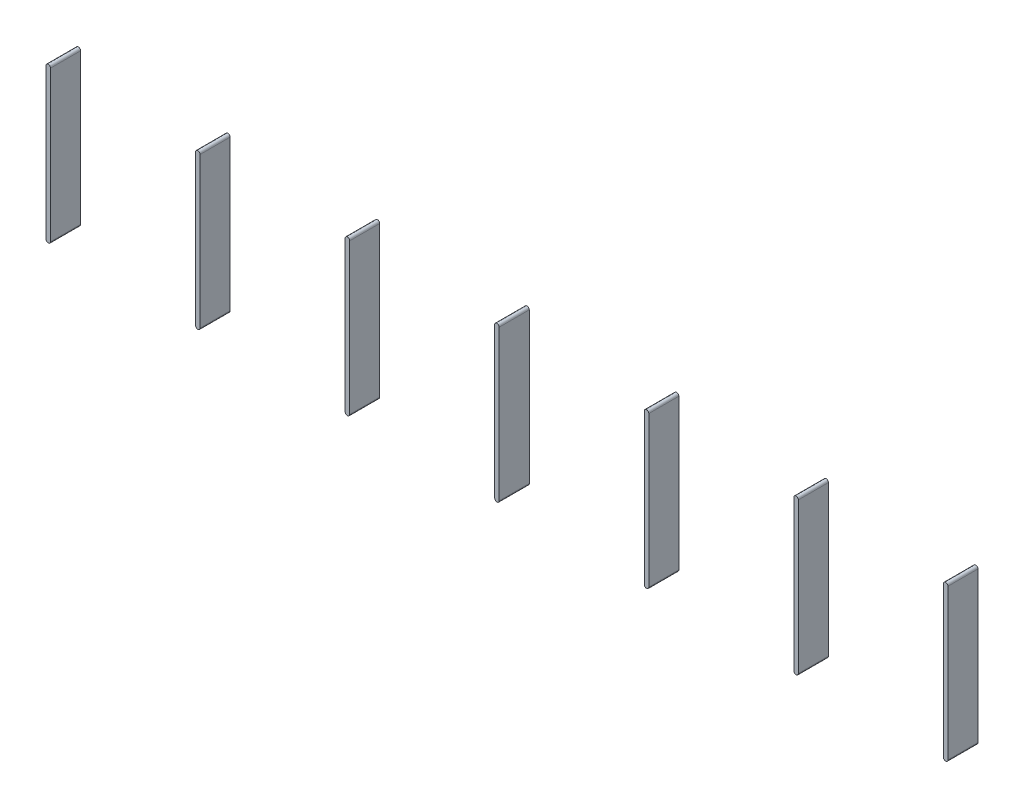
from build123d import *

# Parameters (mm, degrees)
BOSS_EXTRUDE1_DEPTH   = 4
BOSS_EXTRUDE1_2_DEPTH = 4
BOSS_EXTRUDE1_3_DEPTH = 4
BOSS_EXTRUDE1_4_DEPTH = 4
BOSS_EXTRUDE1_5_DEPTH = 4
BOSS_EXTRUDE1_6_DEPTH = 4
BOSS_EXTRUDE1_7_DEPTH = 4


with BuildPart() as part:
    # Sketch1 → Boss-Extrude1 (new body)
    with BuildSketch(Plane.XY):
        with BuildLine():
            Line((0.3, 0), (0.3, -20))
            ThreePointArc((0.3, -20), (0, -20.3), (-0.3, -20))
            Line((-0.3, -20), (-0.3, 0))
            ThreePointArc((-0.3, 0), (0, 0.3), (0.3, 0))
        make_face()
    extrude(amount=BOSS_EXTRUDE1_DEPTH)


with BuildPart() as body_2:
    # Sketch1 → Boss-Extrude1 2 (new body)
    with BuildSketch(Plane.XY):
        with BuildLine():
            Line((40.1, 0), (40.1, -20))
            ThreePointArc((40.1, -20), (39.8, -20.3), (39.5, -20))
            Line((39.5, -20), (39.5, 0))
            ThreePointArc((39.5, 0), (39.8, 0.3), (40.1, 0))
        make_face()
    extrude(amount=BOSS_EXTRUDE1_2_DEPTH)


with BuildPart() as body_3:
    # Sketch1 → Boss-Extrude1 3 (new body)
    with BuildSketch(Plane.XY):
        with BuildLine():
            Line((20.2, 0), (20.2, -20))
            ThreePointArc((20.2, -20), (19.9, -20.3), (19.6, -20))
            Line((19.6, -20), (19.6, 0))
            ThreePointArc((19.6, 0), (19.9, 0.3), (20.2, 0))
        make_face()
    extrude(amount=BOSS_EXTRUDE1_3_DEPTH)


with BuildPart() as body_4:
    # Sketch1 → Boss-Extrude1 4 (new body)
    with BuildSketch(Plane.XY):
        with BuildLine():
            Line((-19.6, 0), (-19.6, -20))
            ThreePointArc((-19.6, -20), (-19.9, -20.3), (-20.2, -20))
            Line((-20.2, -20), (-20.2, 0))
            ThreePointArc((-20.2, 0), (-19.9, 0.3), (-19.6, 0))
        make_face()
    extrude(amount=BOSS_EXTRUDE1_4_DEPTH)


with BuildPart() as body_5:
    # Sketch1 → Boss-Extrude1 5 (new body)
    with BuildSketch(Plane.XY):
        with BuildLine():
            Line((-39.5, 0), (-39.5, -20))
            ThreePointArc((-39.5, -20), (-39.8, -20.3), (-40.1, -20))
            Line((-40.1, -20), (-40.1, 0))
            ThreePointArc((-40.1, 0), (-39.8, 0.3), (-39.5, 0))
        make_face()
    extrude(amount=BOSS_EXTRUDE1_5_DEPTH)


with BuildPart() as body_6:
    # Sketch1 → Boss-Extrude1 6 (new body)
    with BuildSketch(Plane.XY):
        with BuildLine():
            Line((-59.4, 0), (-59.4, -20))
            ThreePointArc((-59.4, -20), (-59.7, -20.3), (-60, -20))
            Line((-60, -20), (-60, 0))
            ThreePointArc((-60, 0), (-59.7, 0.3), (-59.4, 0))
        make_face()
    extrude(amount=BOSS_EXTRUDE1_6_DEPTH)


with BuildPart() as body_7:
    # Sketch1 → Boss-Extrude1 7 (new body)
    with BuildSketch(Plane.XY):
        with BuildLine():
            Line((-79.3, 0), (-79.3, -20))
            ThreePointArc((-79.3, -20), (-79.6, -20.3), (-79.9, -20))
            Line((-79.9, -20), (-79.9, 0))
            ThreePointArc((-79.9, 0), (-79.6, 0.3), (-79.3, 0))
        make_face()
    extrude(amount=BOSS_EXTRUDE1_7_DEPTH)


solid = Compound([part.part, body_2.part, body_3.part, body_4.part, body_5.part, body_6.part, body_7.part])
